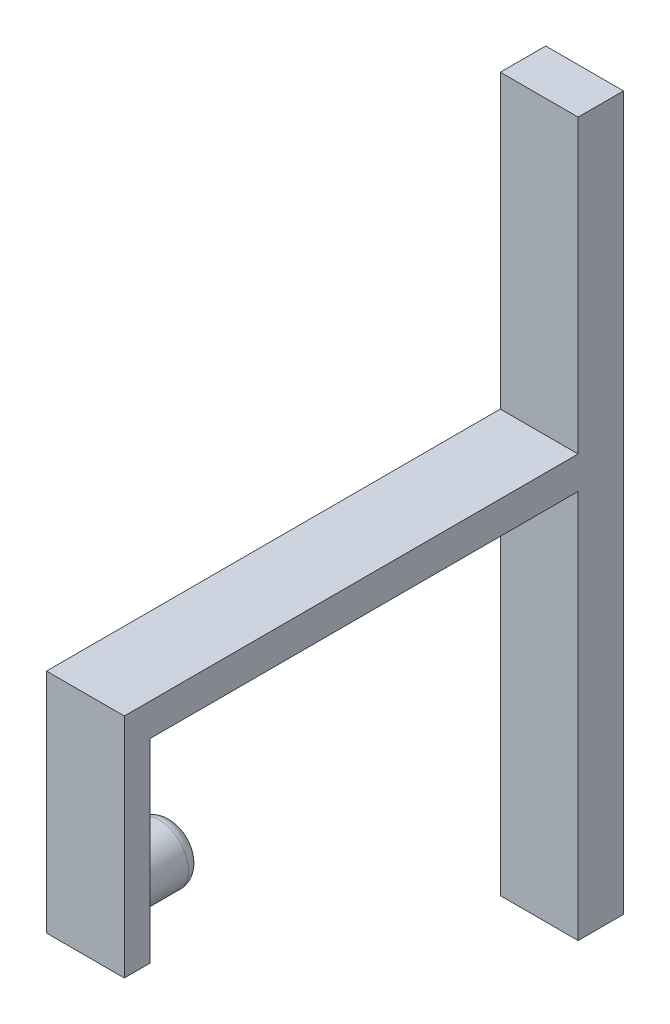
from build123d import *

# Parameters (mm, degrees)
ESQUISSE1_W        = 6
ESQUISSE1_H        = 55
BOSS_EXTRU_1_DEPTH = 3.5
ESQUISSE2_W        = 6
ESQUISSE2_H        = 2.5
BOSS_EXTRU_2_DEPTH = 35
ESQUISSE4_W        = 6
ESQUISSE4_H        = 2
BOSS_EXTRU_3_DEPTH = 15
ESQUISSE10_R       = 2.25
BOSS_EXTRU_4_DEPTH = 4.7
CONG_5_R           = 1


with BuildPart() as part:
    # Esquisse1 → Boss.-Extru.1 (new body)
    with BuildSketch(Plane.XY):
        with Locations((3, 27.5)):
            Rectangle(ESQUISSE1_W, ESQUISSE1_H)
    extrude(amount=BOSS_EXTRU_1_DEPTH)

    # Esquisse2 → Boss.-Extru.2 (add)
    with BuildSketch(Plane.XY.offset(3.5)):
        with Locations((3, 31.25)):
            Rectangle(ESQUISSE2_W, ESQUISSE2_H)
    extrude(amount=BOSS_EXTRU_2_DEPTH)

    # Esquisse4 → Boss.-Extru.3 (add)
    with BuildSketch(Plane(origin=(0, 30, 0), x_dir=(-1, 0, 0), z_dir=(0, -1, 0))):
        with Locations((-3, -37.5)):
            Rectangle(ESQUISSE4_W, ESQUISSE4_H)
    extrude(amount=BOSS_EXTRU_3_DEPTH)

    # Esquisse10 → Boss.-Extru.4 (add)
    with BuildSketch(Plane(origin=(0, 0, 36.5), x_dir=(-1, 0, 0), z_dir=(0, 0, -1))):
        with Locations(Location((-3, 18.95, 0), (0, 0, 180))):
            Circle(ESQUISSE10_R)
    extrude(amount=BOSS_EXTRU_4_DEPTH)

    # Congé5
    cong_5_edges = [part.edges().sort_by_distance(p)[0] for p in [
        (0.75, 18.95, 31.8),
    ]]
    fillet(cong_5_edges, radius=CONG_5_R)


solid = part.part
